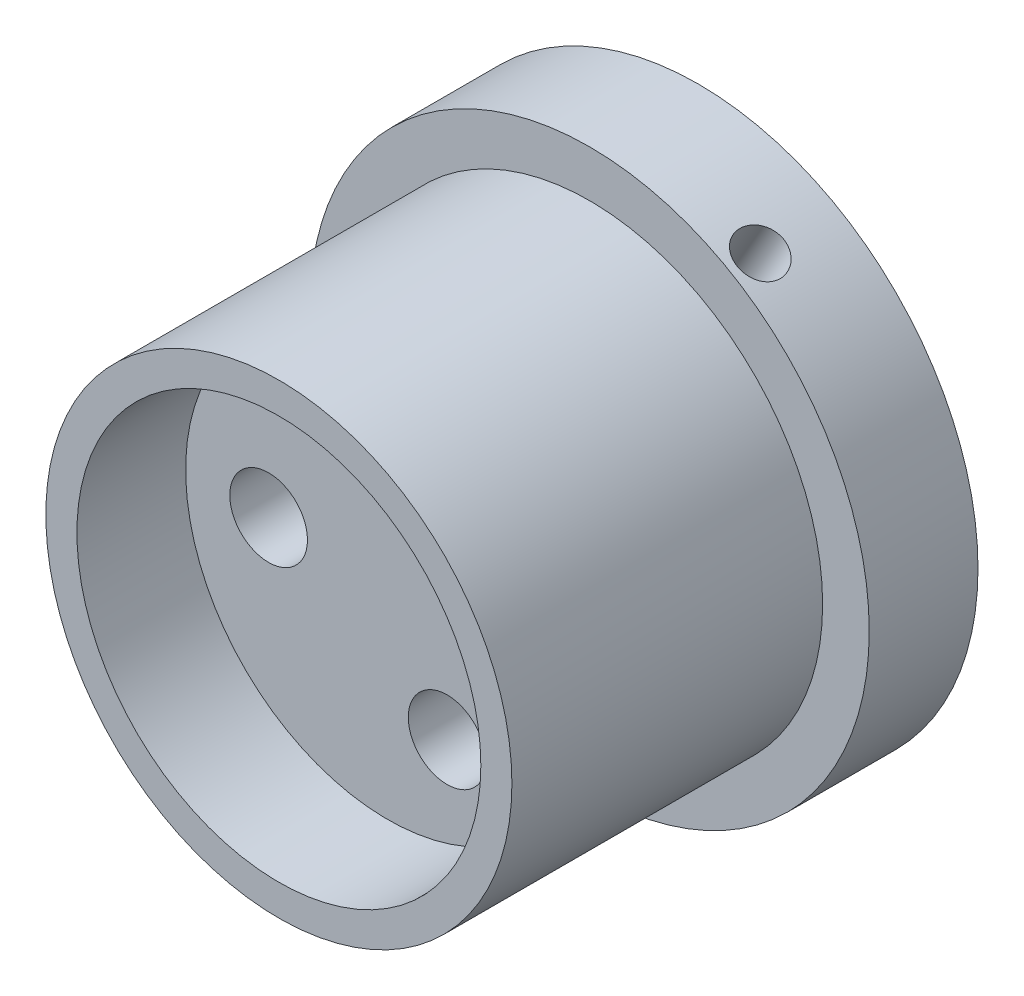
from build123d import *

# Parameters (mm, degrees)
SKETCH1_R                = 15
BOSS_EXTRUDE1_DEPTH      = 20
SKETCH2_R                = 10.95
BOSS_EXTRUDE2_DEPTH      = 3.5
SKETCH4_R                = 3.05
CUT_EXTRUDE1_DEPTH       = 4.1
SKETCH5_R                = 1.5
CUT_EXTRUDE2_DEPTH       = 4
SKETCH7_R                = 10.95
SKETCH7_R_2              = 3
BOSS_EXTRUDE3_DEPTH      = 11
SKETCH9_R                = 1.5
CUT_EXTRUDE4_DEPTH       = 41.5
BOSS_EXTRUDE4_START      = 7
SKETCH12_R               = 18
SKETCH12_R_2             = 3.25
SKETCH12_R_3             = 3.05
BOSS_EXTRUDE4_DEPTH      = 7
CUT_EXTRUDE9_START       = -5
SKETCH13_R               = 1.5
CUT_EXTRUDE9_DEPTH       = 17
CIRPATTERN1_COUNT        = 3
CUT_EXTRUDE12_DEPTH      = 15
CUT_EXTRUDE12_DEPTH_BACK = 38.1079508
SKETCH15_R               = 13
SKETCH15_R_2             = 10.95
BOSS_EXTRUDE6_START      = 13
SKETCH17_R               = 13
BOSS_EXTRUDE6_DEPTH      = 20
SKETCH19_R               = 2.5
CUT_EXTRUDE13_DEPTH      = 38.107950728
SKETCH20_R               = 5
SKETCH20_R_2             = 2.5
CUT_EXTRUDE14_DEPTH      = 5


with BuildPart() as part:
    # Sketch1 → Boss-Extrude1 (new body)
    with BuildSketch(Plane.XY):
        Circle(SKETCH1_R)
    extrude(amount=BOSS_EXTRUDE1_DEPTH)

    # Sketch2 → Boss-Extrude2 (add)
    with BuildSketch(Plane.XY.offset(20)):
        Circle(SKETCH2_R)
    extrude(amount=BOSS_EXTRUDE2_DEPTH)

    # Sketch4 → Cut-Extrude1 (cut)
    with BuildSketch(Plane(origin=(0, 0, 0), x_dir=(-1, 0, 0), z_dir=(0, 0, -1))):
        Circle(SKETCH4_R)
    extrude(amount=-CUT_EXTRUDE1_DEPTH, mode=Mode.SUBTRACT)

    # Sketch5 → Cut-Extrude2 (cut)
    with BuildSketch(Plane(origin=(0, 0, 4.1), x_dir=(-1, 0, 0), z_dir=(0, 0, -1))):
        Circle(SKETCH5_R)
    extrude(amount=-CUT_EXTRUDE2_DEPTH, mode=Mode.SUBTRACT)

    # Sketch7 → Boss-Extrude3 (add)
    with BuildSketch(Plane.XY.offset(23.5)):
        Circle(SKETCH7_R)
        Circle(SKETCH7_R_2, mode=Mode.SUBTRACT)
    extrude(amount=BOSS_EXTRUDE3_DEPTH)

    # Sketch9 → Cut-Extrude4 (cut, through all)
    with BuildSketch(Plane.XY.offset(34.5)):
        with Locations((7, 0)):
            Circle(SKETCH9_R)
        with Locations((-3.5, -6.062177826)):
            Circle(SKETCH9_R)
        with Locations((-3.5, 6.062177826)):
            Circle(SKETCH9_R)
    extrude(amount=-CUT_EXTRUDE4_DEPTH, mode=Mode.SUBTRACT)

    # Sketch12 → Boss-Extrude4 (add)
    with BuildSketch(Plane(origin=(0, 0, 0), x_dir=(-1, 0, 0), z_dir=(0, 0, -1)).offset(BOSS_EXTRUDE4_START)):
        Circle(SKETCH12_R)
        with Locations((3.5, 6.062177826)):
            Circle(SKETCH12_R_2, mode=Mode.SUBTRACT)
        with Locations((3.5, -6.062177826)):
            Circle(SKETCH12_R_2, mode=Mode.SUBTRACT)
        with Locations((-7, 0)):
            Circle(SKETCH12_R_2, mode=Mode.SUBTRACT)
        Circle(SKETCH12_R_3, mode=Mode.SUBTRACT)
    extrude(amount=-BOSS_EXTRUDE4_DEPTH)

    # Sketch13 → Cut-Extrude9 (cut)
    with BuildSketch(Plane(origin=(0, 0, 0), x_dir=(0, 0, -1), z_dir=(1, 0, 0)).offset(CUT_EXTRUDE9_START)):
        with Locations((2, 0)):
            Circle(SKETCH13_R)
    cut_extrude9 = extrude(amount=-CUT_EXTRUDE9_DEPTH, mode=Mode.SUBTRACT)

    # CirPattern1: Cut-Extrude9 ×3 about axis
    cirpattern1_axis = Axis((0, 0, 0), (0, 0, 1))
    for i in range(1, CIRPATTERN1_COUNT):
        add(cut_extrude9.rotate(cirpattern1_axis, i * 360 / CIRPATTERN1_COUNT), mode=Mode.SUBTRACT)

    # Sketch15 → Cut-Extrude12 (cut, two sides: drawn at the far end of the back side and taken through both)
    # profile 1 of 2: a face of its own
    with BuildSketch(Plane.XY.offset(20).offset(-CUT_EXTRUDE12_DEPTH_BACK)):
        Circle(SKETCH15_R)
        Circle(SKETCH15_R_2, mode=Mode.SUBTRACT)
    # profile 2 of 2: a face of its own
    with BuildSketch(Plane.XY.offset(20).offset(-CUT_EXTRUDE12_DEPTH_BACK)):
        Circle(SKETCH15_R_2)
    extrude(amount=CUT_EXTRUDE12_DEPTH + CUT_EXTRUDE12_DEPTH_BACK, mode=Mode.SUBTRACT)

    # Sketch17 → Boss-Extrude6 (add)
    with BuildSketch(Plane.XY.offset(BOSS_EXTRUDE6_START)):
        Circle(SKETCH17_R)
    extrude(amount=-BOSS_EXTRUDE6_DEPTH)

    # Sketch19 → Cut-Extrude13 (cut, through all)
    with BuildSketch(Plane(origin=(0, 0, -7), x_dir=(-1, 0, 0), z_dir=(0, 0, -1))):
        with Locations((7.66, 0)):
            Circle(SKETCH19_R)
        with Locations((-3.83, -6.633754593)):
            Circle(SKETCH19_R)
        with Locations((-3.83, 6.633754593)):
            Circle(SKETCH19_R)
    extrude(amount=-CUT_EXTRUDE13_DEPTH, mode=Mode.SUBTRACT)

    # Sketch20 → Cut-Extrude14 (cut)
    # profile 1 of 3: a face of its own
    with BuildSketch(Plane(origin=(0, 0, -7), x_dir=(-1, 0, 0), z_dir=(0, 0, -1))):
        with Locations((7.66, 0)):
            Circle(SKETCH20_R)
        with Locations((7.66, 0)):
            Circle(SKETCH20_R_2, mode=Mode.SUBTRACT)
    # profile 2 of 3: a face of its own
    with BuildSketch(Plane(origin=(0, 0, -7), x_dir=(-1, 0, 0), z_dir=(0, 0, -1))):
        with Locations((-3.83, 6.633754593)):
            Circle(SKETCH20_R)
        with Locations((-3.83, 6.633754593)):
            Circle(SKETCH20_R_2, mode=Mode.SUBTRACT)
    # profile 3 of 3: a face of its own
    with BuildSketch(Plane(origin=(0, 0, -7), x_dir=(-1, 0, 0), z_dir=(0, 0, -1))):
        with Locations((-3.83, -6.633754593)):
            Circle(SKETCH20_R)
        with Locations((-3.83, -6.633754593)):
            Circle(SKETCH20_R_2, mode=Mode.SUBTRACT)
    extrude(amount=-CUT_EXTRUDE14_DEPTH, mode=Mode.SUBTRACT)


solid = part.part
